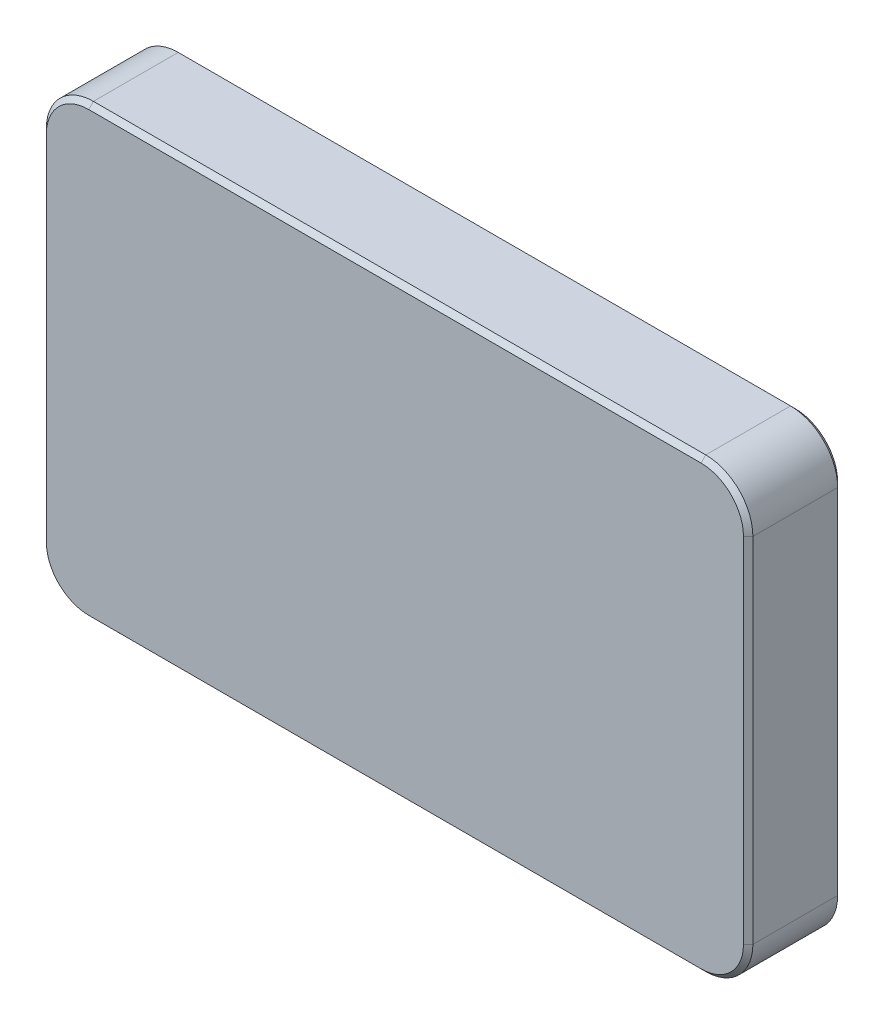
from build123d import *

# Parameters (mm, degrees)
SKETCH1_W           = 15
SKETCH1_H           = 9.5
BOSS_EXTRUDE1_DEPTH = 2
FILLET1_R           = 1
CHAMFER1_SIZE       = 0.1


with BuildPart() as part:
    # Sketch1 → Boss-Extrude1 (new body)
    with BuildSketch(Plane.XY):
        Rectangle(SKETCH1_W, SKETCH1_H)
    extrude(amount=BOSS_EXTRUDE1_DEPTH)

    # Fillet1
    fillet1_edges = [part.edges().sort_by_distance(p)[0] for p in [
        (-7.5, 4.75, 1),
        (7.5, 4.75, 1),
        (7.5, -4.75, 1),
        (-7.5, -4.75, 1),
    ]]
    fillet(fillet1_edges, radius=FILLET1_R)

    # Chamfer1
    chamfer1_edges = [part.edges().sort_by_distance(p)[0] for p in [
        (0, -4.75, 0),
        (0, -4.75, 2),
        (-7.5, 0, 0),
        (0, 4.75, 0),
        (7.5, 0, 0),
        (7.207106781, 4.457106781, 0),
        (7.207106781, -4.457106781, 0),
        (-7.207106781, 4.457106781, 0),
        (-7.207106781, -4.457106781, 0),
        (-7.5, 0, 2),
        (7.5, 0, 2),
        (0, 4.75, 2),
        (7.207106781, 4.457106781, 2),
        (7.207106781, -4.457106781, 2),
        (-7.207106781, 4.457106781, 2),
        (-7.207106781, -4.457106781, 2),
    ]]
    chamfer(chamfer1_edges, length=CHAMFER1_SIZE)


solid = part.part
